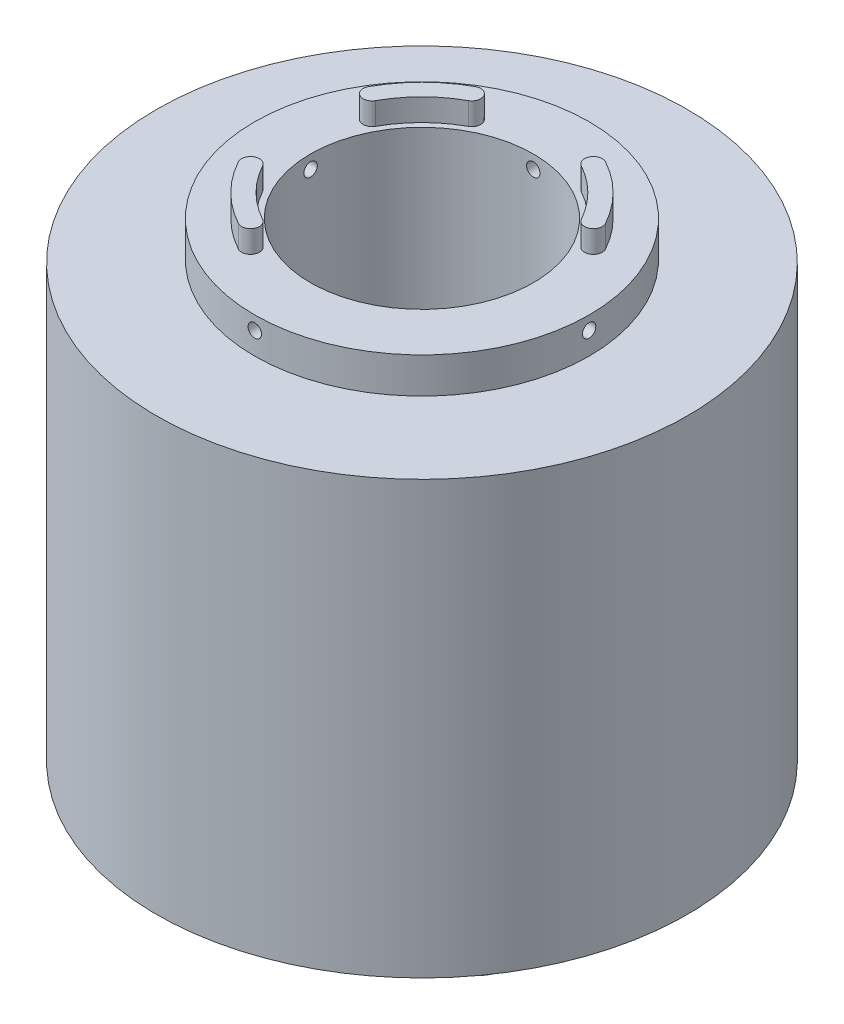
from build123d import *
from build123d.topology import SkipClean

# Parameters (mm, degrees)
SKETCH_1_W               = 34.5
SKETCH_1_H               = 96.8
SKETCH_3_R               = 1.5
CUT_EXTRUDE_1_DEPTH      = 102.634147805
PATTERN_CIRCULAR_1_COUNT = 4
EXTRUDE_2_DEPTH          = 5
EXTRUDE_3_DEPTH          = 5
SKETCH_4_R               = 2
CUT_EXTRUDE_2_DEPTH      = 8


with BuildPart() as part:
    # 草图1 → 旋转1 (revolve)
    with SkipClean():  # the faces are left unmerged after this step: merging them gives an invalid solid
        with BuildSketch(Plane.XY, mode=Mode.PRIVATE) as revolve_1_sk:
            with Locations((42.25, 0)):
                Rectangle(SKETCH_1_W, SKETCH_1_H)
            Polygon((-25, 57), (-37.5, 57), (-37.5, 49), (-32.5, 49), (-32.5, 48.4), (-59.5, 48.4), (-59.5, -48.4), (-25, -48.4), align=None)
        revolve(revolve_1_sk.sketch.rotate(Axis((0, 57, 0), (0, -1, 0)), 180), axis=Axis((0, 57, 0), (0, -1, 0)))

    # 草图3 → 切除-拉伸1 (cut, through all)
    with SkipClean():  # the faces are left unmerged after this step: merging them gives an invalid solid
        with BuildSketch(Plane.XY):
            with Locations((0, 54)):
                Circle(SKETCH_3_R)
        cut_extrude_1 = extrude(amount=-CUT_EXTRUDE_1_DEPTH, mode=Mode.SUBTRACT)

    # 阵列(圆周)1: 切除-拉伸1 ×4 about axis
    with SkipClean():  # the faces are left unmerged after this step: merging them gives an invalid solid
        pattern_circular_1_axis = Axis((0, 57, 0), (0, 1, 0))
        for i in range(1, PATTERN_CIRCULAR_1_COUNT):
            add(cut_extrude_1.rotate(pattern_circular_1_axis, i * 360 / PATTERN_CIRCULAR_1_COUNT), mode=Mode.SUBTRACT)

    # 草图5 → 凸台-拉伸2 (add)
    with SkipClean():  # the faces are left unmerged after this step: merging them gives an invalid solid
        with BuildSketch(Plane(origin=(0, 57, 0), x_dir=(1, 0, 0), z_dir=(0, 1, 0))):
            with BuildLine():
                ThreePointArc((14.592688862, 26.554536934), (21.42533547, 21.42533547), (26.554536934, 14.592688862))
                ThreePointArc((26.554536934, 14.592688862), (25.764976005, 11.876700361), (23.048987504, 12.66626129))
                ThreePointArc((23.048987504, 12.66626129), (18.596908345, 18.596908345), (12.66626129, 23.048987504))
                ThreePointArc((12.66626129, 23.048987504), (11.876700361, 25.764976005), (14.592688862, 26.554536934))
            make_face()
            with BuildLine():
                ThreePointArc((-26.554536934, -14.592688862), (-25.764976005, -11.876700361), (-23.048987504, -12.66626129))
                ThreePointArc((-23.048987504, -12.66626129), (-18.596908345, -18.596908345), (-12.66626129, -23.048987504))
                ThreePointArc((-12.66626129, -23.048987504), (-11.876700361, -25.764976005), (-14.592688862, -26.554536934))
                ThreePointArc((-14.592688862, -26.554536934), (-21.42533547, -21.42533547), (-26.554536934, -14.592688862))
            make_face()
            with BuildLine():
                ThreePointArc((-14.592688862, 26.554536934), (-11.876700361, 25.764976005), (-12.66626129, 23.048987504))
                ThreePointArc((-12.66626129, 23.048987504), (-18.596908345, 18.596908345), (-23.048987504, 12.66626129))
                ThreePointArc((-23.048987504, 12.66626129), (-25.764976005, 11.876700361), (-26.554536934, 14.592688862))
                ThreePointArc((-26.554536934, 14.592688862), (-21.42533547, 21.42533547), (-14.592688862, 26.554536934))
            make_face()
        extrude(amount=EXTRUDE_2_DEPTH)

    # 草图6 → 凸台-拉伸3 (add)
    with SkipClean():  # the faces are left unmerged after this step: merging them gives an invalid solid
        with BuildSketch(Plane.XZ.offset(48.4)):
            with BuildLine():
                Line((43.716333699, 29.281088913), (47.216333699, 23.218911087))
                ThreePointArc((47.216333699, 23.218911087), (45.935244785, 18.437822174), (41.154155872, 19.718911087))
                Line((41.154155872, 19.718911087), (37.654155872, 25.781088913))
                ThreePointArc((37.654155872, 25.781088913), (38.935244785, 30.562177826), (43.716333699, 29.281088913))
            make_face()
            with BuildLine():
                Line((43.716333699, -29.281088913), (47.216333699, -23.218911087))
                ThreePointArc((47.216333699, -23.218911087), (45.935244785, -18.437822174), (41.154155872, -19.718911087))
                Line((41.154155872, -19.718911087), (37.654155872, -25.781088913))
                ThreePointArc((37.654155872, -25.781088913), (38.935244785, -30.562177826), (43.716333699, -29.281088913))
            make_face()
            with BuildLine():
                Line((-43.716333699, -29.281088913), (-47.216333699, -23.218911087))
                ThreePointArc((-47.216333699, -23.218911087), (-45.935244785, -18.437822174), (-41.154155872, -19.718911087))
                Line((-41.154155872, -19.718911087), (-37.654155872, -25.781088913))
                ThreePointArc((-37.654155872, -25.781088913), (-38.935244785, -30.562177826), (-43.716333699, -29.281088913))
            make_face()
            with BuildLine():
                Line((-43.716333699, 29.281088913), (-47.216333699, 23.218911087))
                ThreePointArc((-47.216333699, 23.218911087), (-45.935244785, 18.437822174), (-41.154155872, 19.718911087))
                Line((-41.154155872, 19.718911087), (-37.654155872, 25.781088913))
                ThreePointArc((-37.654155872, 25.781088913), (-38.935244785, 30.562177826), (-43.716333699, 29.281088913))
            make_face()
        extrude(amount=EXTRUDE_3_DEPTH)

    # 草图4 → 切除-拉伸2 (cut)
    with SkipClean():  # the faces are left unmerged after this step: merging them gives an invalid solid
        with BuildSketch(Plane.XZ.offset(48.4)):
            with Locations((-6.25, 51.75)):
                Circle(SKETCH_4_R)
            with Locations(Location((6.25, 51.75, 0), (0, 0, 180))):
                Circle(SKETCH_4_R)
            with Locations(Location((-6.25, -51.75, 0), (0, 0, 180))):
                Circle(SKETCH_4_R)
            with Locations((6.25, -51.75)):
                Circle(SKETCH_4_R)
        extrude(amount=-CUT_EXTRUDE_2_DEPTH, mode=Mode.SUBTRACT)


solid = part.part
